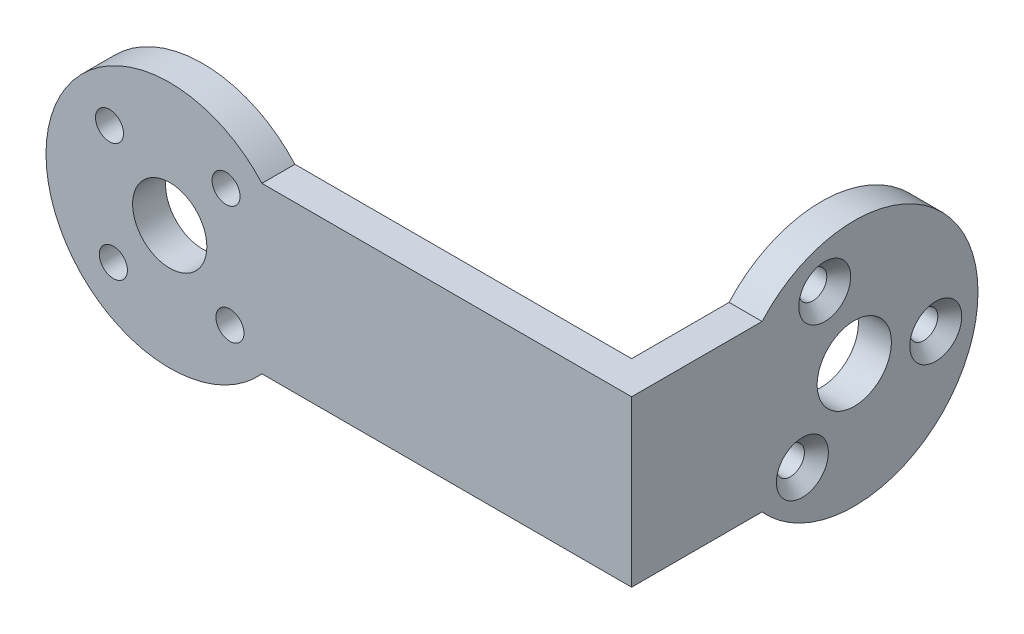
from build123d import *

# Parameters (mm, degrees)
ESQUISSE1_R                                    = 4.5
ESQUISSE1_R_2                                  = 1.5
BOSS_EXTRU_1_DEPTH                             = 4
ESQUISSE3_R                                    = 4.5
ESQUISSE3_R_2                                  = 1.500083245
BOSS_EXTRU_2_DEPTH                             = 4
FRAISAGE_POUR_VIS_T_TE_FRAIS_E_M31_D           = 3.4
FRAISAGE_POUR_VIS_T_TE_FRAIS_E_M31_CSINK_D     = 6.3
FRAISAGE_POUR_VIS_T_TE_FRAIS_E_M31_CSINK_ANGLE = 90
FRAISAGE_POUR_VIS_T_TE_FRAIS_E_M32_D           = 3.4
FRAISAGE_POUR_VIS_T_TE_FRAIS_E_M32_CSINK_D     = 6.3
FRAISAGE_POUR_VIS_T_TE_FRAIS_E_M32_CSINK_ANGLE = 90


with BuildPart() as part:
    # Esquisse1 → Boss.-Extru.1 (new body)
    with BuildSketch(Plane.XY):
        with BuildLine():
            Line((11.180339887, 10), (56, 10))
            Line((56, 10), (56, -10))
            Line((56, -10), (11.180339887, -10))
            ThreePointArc((11.180339887, -10), (-15, 0), (11.180339887, 10))
        make_face()
        Circle(ESQUISSE1_R, mode=Mode.SUBTRACT)
        with Locations((-7.303420571, 6.830816054)):
            Circle(ESQUISSE1_R_2, mode=Mode.SUBTRACT)
        with Locations((6.830816054, 7.303420571)):
            Circle(ESQUISSE1_R_2, mode=Mode.SUBTRACT)
        with Locations((7.303420571, -6.830816054)):
            Circle(ESQUISSE1_R_2, mode=Mode.SUBTRACT)
        with Locations((-6.830816054, -7.303420571)):
            Circle(ESQUISSE1_R_2, mode=Mode.SUBTRACT)
    extrude(amount=BOSS_EXTRU_1_DEPTH)

    # Esquisse3 → Boss.-Extru.2 (add)
    with BuildSketch(Plane(origin=(56, 0, 0), x_dir=(0, 0, -1), z_dir=(1, 0, 0))):
        with BuildLine():
            Line((0, 10), (11.819660113, 10))
            ThreePointArc((11.819660113, 10), (38, 0), (11.819660113, -10))
            Line((11.819660113, -10), (0, -10))
            Line((0, -10), (0, 10))
        make_face()
        with Locations((23, 0)):
            Circle(ESQUISSE3_R, mode=Mode.SUBTRACT)
        with Locations((19.416309522, 9.335800049)):
            Circle(ESQUISSE3_R_2, mode=Mode.SUBTRACT)
        with Locations((32.876885246, -1.564333031)):
            Circle(ESQUISSE3_R_2, mode=Mode.SUBTRACT)
        with Locations((16.706805232, -7.771467018)):
            Circle(ESQUISSE3_R_2, mode=Mode.SUBTRACT)
    extrude(amount=-BOSS_EXTRU_2_DEPTH)

    # Fraisage pour vis à tête fraisée M31 (through all)
    with Locations(Plane(origin=(0, 0, 0), x_dir=(-1, 0, 0), z_dir=(0, 0, -1))):
        with Locations((-6.830816054, 7.303420571), (7.303420571, 6.830816054), (6.830816054, -7.303420571), (-7.303420571, -6.830816054)):
            CounterSinkHole(FRAISAGE_POUR_VIS_T_TE_FRAIS_E_M31_D / 2, FRAISAGE_POUR_VIS_T_TE_FRAIS_E_M31_CSINK_D / 2, counter_sink_angle=FRAISAGE_POUR_VIS_T_TE_FRAIS_E_M31_CSINK_ANGLE)

    # Fraisage pour vis à tête fraisée M32 (through all)
    with Locations(Plane(origin=(56, 0, 0), x_dir=(0, 0, -1), z_dir=(1, 0, 0))):
        with Locations((19.416309522, 9.335800049), (32.876885246, -1.564333031), (16.706805232, -7.771467018)):
            CounterSinkHole(FRAISAGE_POUR_VIS_T_TE_FRAIS_E_M32_D / 2, FRAISAGE_POUR_VIS_T_TE_FRAIS_E_M32_CSINK_D / 2, counter_sink_angle=FRAISAGE_POUR_VIS_T_TE_FRAIS_E_M32_CSINK_ANGLE)


solid = part.part
